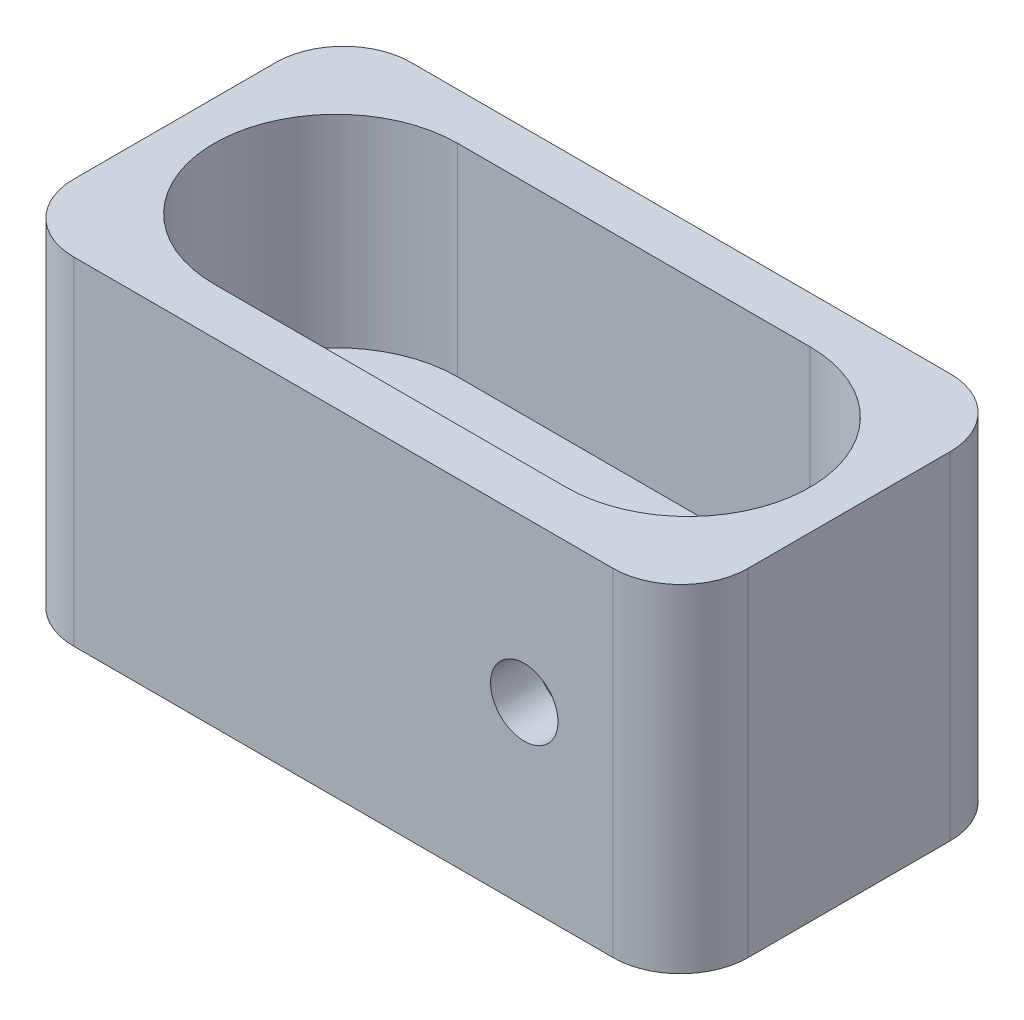
from build123d import *

# Parameters (mm, degrees)
SKETCH1_W           = 50
SKETCH1_H           = 25
BOSS_EXTRUDE1_DEPTH = 25
FILLET2_R           = 5
CUT_EXTRUDE1_DEPTH  = 15
SKETCH3_R           = 2.5
CUT_EXTRUDE2_DEPTH  = 10


with BuildPart() as part:
    # Sketch1 → Boss-Extrude1 (new body)
    with BuildSketch(Plane(origin=(0, 0, 0), x_dir=(1, 0, 0), z_dir=(0, 1, 0))):
        Rectangle(SKETCH1_W, SKETCH1_H)
    extrude(amount=BOSS_EXTRUDE1_DEPTH)

    # Fillet2
    fillet2_edges = [part.edges().sort_by_distance(p)[0] for p in [
        (25, 12.5, 12.5),
        (-25, 12.5, 12.5),
        (-25, 12.5, -12.5),
        (25, 12.5, -12.5),
    ]]
    fillet(fillet2_edges, radius=FILLET2_R)

    # Sketch2 → Cut-Extrude1 (cut)
    with BuildSketch(Plane(origin=(0, 25, 0), x_dir=(1, 0, 0), z_dir=(0, 1, 0))):
        with BuildLine():
            Line((-13.058351702, 9.034247402), (13.06, 9.034247402))
            ThreePointArc((13.06, 9.034247402), (22.094247402, 0), (13.06, -9.034247402))
            Line((13.06, -9.034247402), (-13.058351702, -9.034247402))
            ThreePointArc((-13.058351702, -9.034247402), (-22.092599103, 0), (-13.058351702, 9.034247402))
        make_face()
    extrude(amount=-CUT_EXTRUDE1_DEPTH, mode=Mode.SUBTRACT)

    # Sketch3 → Cut-Extrude2 (cut)
    with BuildSketch(Plane.XY.offset(12.5)):
        with Locations((13.408381173, 13.105781034)):
            Circle(SKETCH3_R)
    extrude(amount=-CUT_EXTRUDE2_DEPTH, mode=Mode.SUBTRACT)


solid = part.part
